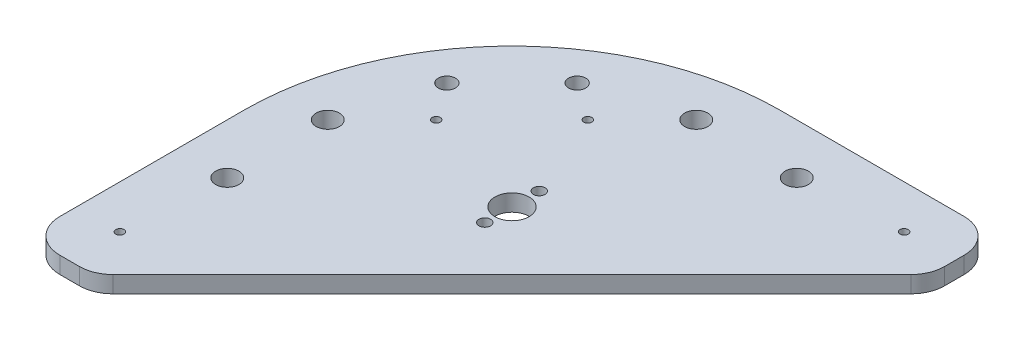
from build123d import *

# Parameters (mm, degrees)
SKETCH1_W                = 184.15
SKETCH1_H                = 184.15
BOSS_EXTRUDE1_DEPTH      = 3.175
CUT_EXTRUDE1_DEPTH       = 131.368453815
SKETCH3_R                = 6.477
SKETCH3_R_2              = 2.20345
CUT_EXTRUDE2_DEPTH       = 131.368453815
F_0_332_DIAMETER_HOLE1_D = 8.8392
FILLET1_R                = 12.7
FILLET2_R                = 101.6
CUT_EXTRUDE3_DEPTH       = 131.368453815
CUT_EXTRUDE3_DEPTH_BACK  = 131.368453815
SKETCH6_R                = 1.5367
SKETCH7_R                = 12.827
SKETCH7_R_2              = 3.2639
CUT_EXTRUDE4_DEPTH       = 131.368453815
SKETCH8_R                = 12.827
BOSS_EXTRUDE2_DEPTH      = 6.35


with BuildPart() as part:
    # Sketch1 → Boss-Extrude1 (new, symmetric)
    with BuildSketch(Plane(origin=(0, 0, 0), x_dir=(1, 0, 0), z_dir=(0, 1, 0))):
        Rectangle(SKETCH1_W, SKETCH1_H)
    extrude(amount=BOSS_EXTRUDE1_DEPTH, both=True)

    # Sketch2 → Cut-Extrude1 (cut, through all)
    with BuildSketch(Plane(origin=(0, 3.175, 0), x_dir=(1, 0, 0), z_dir=(0, 1, 0))):
        Polygon((92.075, -92.075), (92.075, 66.675), (-66.675, -92.075), align=None)
    extrude(amount=-CUT_EXTRUDE1_DEPTH, mode=Mode.SUBTRACT)

    # Sketch3 → Cut-Extrude2 (cut, through all)
    with BuildSketch(Plane(origin=(0, 3.175, 0), x_dir=(1, 0, 0), z_dir=(0, 1, 0))):
        with Locations(Location((-9.525, 9.525, 0), (0, 0, 270))):
            Circle(SKETCH3_R)
        with Locations(Location((-9.525, 19.84375, 0), (0, 0, 270))):
            Circle(SKETCH3_R_2)
        with Locations(Location((-9.525, -0.79375, 0), (0, 0, 270))):
            Circle(SKETCH3_R_2)
    extrude(amount=-CUT_EXTRUDE2_DEPTH, mode=Mode.SUBTRACT)

    # 0.332_ Diameter Hole1 (through all)
    with Locations(Plane(origin=(0, 3.175, 0), x_dir=(1, 0, 0), z_dir=(0, 1, 0))):
        with Locations((-73.025, -34.925), (-3.175, 73.025), (34.925, 73.025), (-73.025, 3.175)):
            Hole(F_0_332_DIAMETER_HOLE1_D / 2)

    # Fillet1
    fillet1_edges = [part.edges().sort_by_distance(p)[0] for p in [
        (-66.675, 0, 92.075),
        (92.075, 0, -66.675),
        (-92.075, 0, 92.075),
        (92.075, 0, -92.075),
    ]]
    fillet(fillet1_edges, radius=FILLET1_R)

    # Fillet2
    fillet2_edges = [part.edges().sort_by_distance(p)[0] for p in [
        (-92.075, 0, -92.075),
    ]]
    fillet(fillet2_edges, radius=FILLET2_R)

    # Sketch6 → Cut-Extrude3 (cut, two sides: drawn at the far end of the back side and taken through both)
    with BuildSketch(Plane.XZ.offset(3.175).offset(-CUT_EXTRUDE3_DEPTH_BACK)):
        with Locations(Location((73.025, -75.655256121, 0), (0, 0, 270))):
            Circle(SKETCH6_R)
        with Locations(Location((-23.731590206, -52.468409794, 0), (0, 0, 270))):
            Circle(SKETCH6_R)
        with Locations(Location((-75.655256121, 73.025, 0), (0, 0, 270))):
            Circle(SKETCH6_R)
        with Locations(Location((-52.468409794, -23.731590206, 0), (0, 0, 270))):
            Circle(SKETCH6_R)
    extrude(amount=CUT_EXTRUDE3_DEPTH + CUT_EXTRUDE3_DEPTH_BACK, mode=Mode.SUBTRACT)

    # Sketch7 → Cut-Extrude4 (cut, through all)
    with BuildSketch(Plane.XZ.offset(3.175)):
        with Locations(Location((-50.161792847, -50.161792847, 0), (0, 0, 270))):
            Circle(SKETCH7_R)
        with Locations(Location((-37.813940681, -62.509645014, 0), (0, 0, 270))):
            Circle(SKETCH7_R_2)
        with Locations(Location((-62.509645014, -37.813940681, 0), (0, 0, 270))):
            Circle(SKETCH7_R_2)
    extrude(amount=-CUT_EXTRUDE4_DEPTH, mode=Mode.SUBTRACT)

    # Sketch8 → Boss-Extrude2 (add)
    with BuildSketch(Plane.XZ.offset(3.175)):
        with Locations((-50.161792847, -50.161792847)):
            Circle(SKETCH8_R)
    extrude(amount=-BOSS_EXTRUDE2_DEPTH)


solid = part.part
